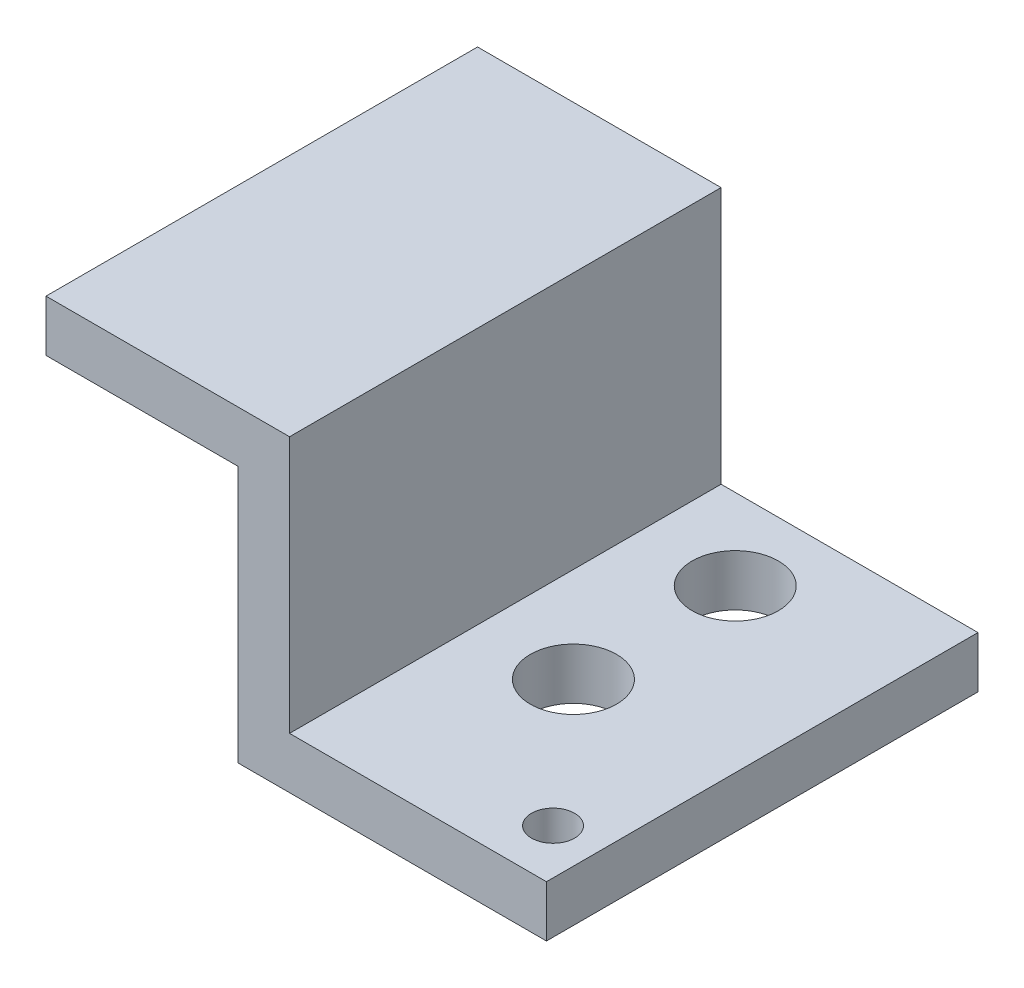
from build123d import *

# Parameters (mm, degrees)
BOSS_EXTRUDE1_DEPTH = 40
SKETCH4_W           = 6
SKETCH4_H           = 40
CUT_EXTRUDE1_DEPTH  = 4.7625
SKETCH5_R           = 4
SKETCH5_R_2         = 2
CUT_EXTRUDE2_DEPTH  = 4.7625


with BuildPart() as part:
    # Sketch3 → Boss-Extrude1 (new body)
    with BuildSketch(Plane.XY):
        Polygon((26.19375, -9.525), (26.19375, -14.2875), (-2.38125, -14.2875), (-2.38125, 9.525), (-26.19375, 9.525), (-26.19375, 14.2875), (2.38125, 14.2875), (2.38125, -9.525), align=None)
    extrude(amount=BOSS_EXTRUDE1_DEPTH)

    # Sketch4 → Cut-Extrude1 (cut)
    with BuildSketch(Plane(origin=(0, 14.2875, 0), x_dir=(1, 0, 0), z_dir=(0, 1, 0))):
        with Locations((-23.19375, -20)):
            Rectangle(SKETCH4_W, SKETCH4_H)
    extrude(amount=-CUT_EXTRUDE1_DEPTH, mode=Mode.SUBTRACT)

    # Sketch5 → Cut-Extrude2 (cut)
    with BuildSketch(Plane.XZ.offset(14.2875)):
        with Locations(Location((11.19375, 7.5, 0), (0, 0, 270))):
            Circle(SKETCH5_R)
        with Locations(Location((11.19375, 22.5, 0), (0, 0, 270))):
            Circle(SKETCH5_R)
        with Locations(Location((22.0033493, 35.1973816, 0), (0, 0, 270))):
            Circle(SKETCH5_R_2)
    extrude(amount=-CUT_EXTRUDE2_DEPTH, mode=Mode.SUBTRACT)


solid = part.part
